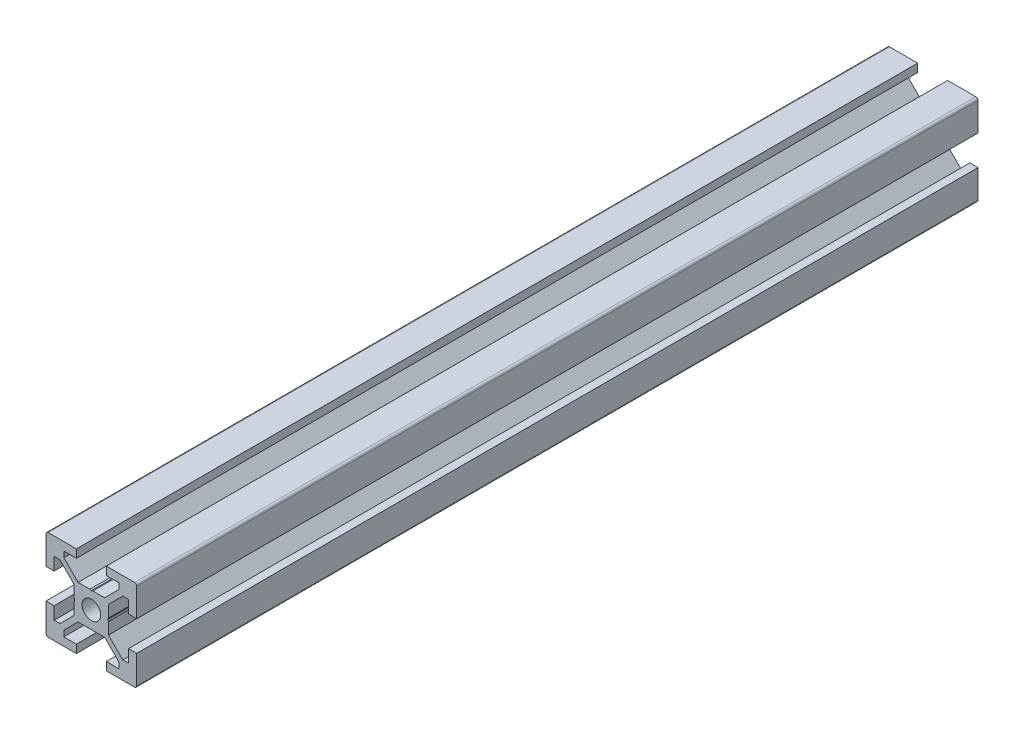
from build123d import *

# Parameters (mm, degrees)
SKETCH1_R           = 2.05
BOSS_EXTRUDE1_DEPTH = 185.5
FILLET1_R           = 0.5


with BuildPart() as part:
    # Sketch1 → Boss-Extrude1 (new body)
    with BuildSketch(Plane.XY):
        Polygon((-3.3, 10), (-3.3, 8.2), (-6.08, 8.2), (-6.08, 6.928528137), (-2.931471863, 3.78), (-0.34, 3.78), (0, 3.66), (0.34, 3.78), (2.931471863, 3.78), (6.08, 6.928528137), (6.08, 8.2), (3.3, 8.2), (3.3, 10), (10, 10), (10, 3.3), (8.2, 3.3), (8.2, 6.08), (6.928528137, 6.08), (3.78, 2.931471863), (3.78, 0.34), (3.66, 0), (3.78, -0.34), (3.78, -2.931471863), (6.928528137, -6.08), (8.2, -6.08), (8.2, -3.3), (10, -3.3), (10, -10), (3.3, -10), (3.3, -8.2), (6.08, -8.2), (6.08, -6.928528137), (2.931471863, -3.78), (0.34, -3.78), (0, -3.66), (-0.34, -3.78), (-2.931471863, -3.78), (-6.08, -6.928528137), (-6.08, -8.2), (-3.3, -8.2), (-3.3, -10), (-10, -10), (-10, -3.3), (-8.2, -3.3), (-8.2, -6.08), (-6.928528137, -6.08), (-3.78, -2.931471863), (-3.78, -0.34), (-3.66, 0), (-3.78, 0.34), (-3.78, 2.931471863), (-6.928528137, 6.08), (-8.2, 6.08), (-8.2, 3.3), (-10, 3.3), (-10, 10), align=None)
        Circle(SKETCH1_R, mode=Mode.SUBTRACT)
    extrude(amount=BOSS_EXTRUDE1_DEPTH)

    # Fillet1
    fillet1_edges = [part.edges().sort_by_distance(p)[0] for p in [
        (10, 10, 92.75),
        (10, -10, 92.75),
        (-10, -10, 92.75),
        (-10, 10, 92.75),
    ]]
    fillet(fillet1_edges, radius=FILLET1_R)


solid = part.part
